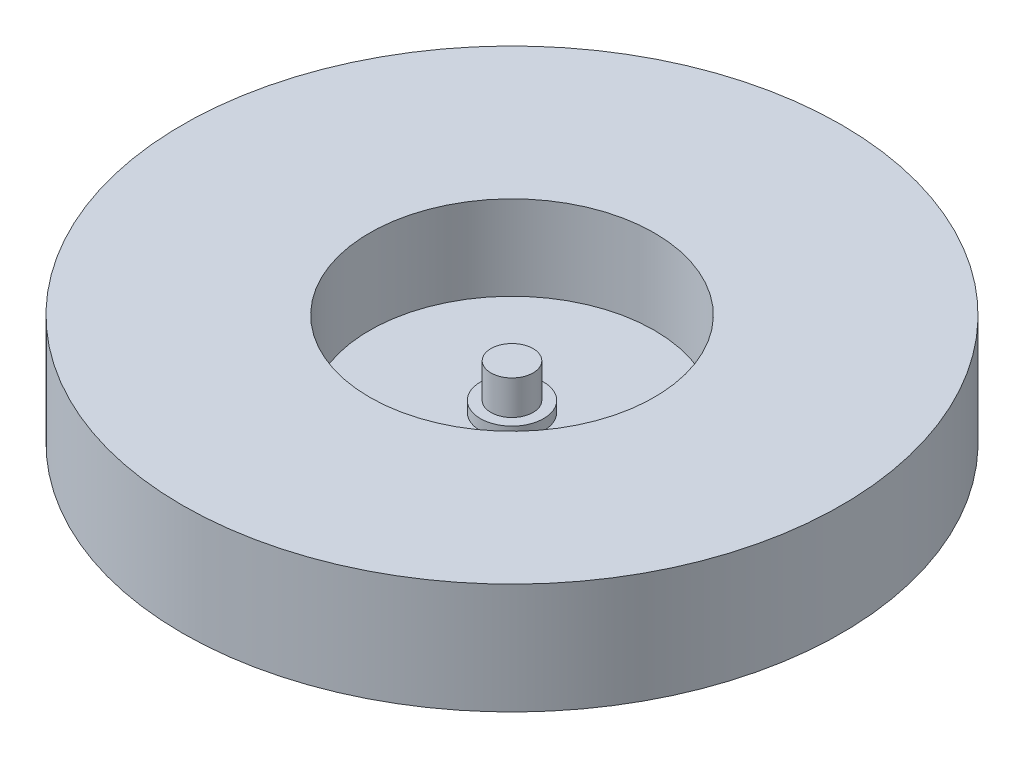
from build123d import *

# Parameters (mm, degrees)
SKETCH1_R           = 62.5
BOSS_EXTRUDE1_DEPTH = 21
SKETCH2_R           = 27
SKETCH2_R_2         = 6
CUT_EXTRUDE1_DEPTH  = 16
SKETCH3_R           = 6
SKETCH3_R_2         = 4
CUT_EXTRUDE2_DEPTH  = 14
SKETCH4_R           = 4
CUT_EXTRUDE3_DEPTH  = 7.5


with BuildPart() as part:
    # Sketch1 → Boss-Extrude1 (new body)
    with BuildSketch(Plane(origin=(0, 0, 0), x_dir=(1, 0, 0), z_dir=(0, 1, 0))):
        with Locations(Location((0, 0, 0), (0, 0, 90))):
            Circle(SKETCH1_R)
    extrude(amount=BOSS_EXTRUDE1_DEPTH)

    # Sketch2 → Cut-Extrude1 (cut)
    with BuildSketch(Plane(origin=(0, 21, 0), x_dir=(1, 0, 0), z_dir=(0, 1, 0))):
        with Locations(Location((0, 0, 0), (0, 0, 270))):
            Circle(SKETCH2_R)
        with Locations(Location((0, 0, 0), (0, 0, 270))):
            Circle(SKETCH2_R_2, mode=Mode.SUBTRACT)
    extrude(amount=-CUT_EXTRUDE1_DEPTH, mode=Mode.SUBTRACT)

    # Sketch3 → Cut-Extrude2 (cut)
    with BuildSketch(Plane(origin=(0, 21, 0), x_dir=(1, 0, 0), z_dir=(0, 1, 0))):
        with Locations(Location((0, 0, 0), (0, 0, 270))):
            Circle(SKETCH3_R)
        with Locations(Location((0, 0, 0), (0, 0, 270))):
            Circle(SKETCH3_R_2, mode=Mode.SUBTRACT)
    extrude(amount=-CUT_EXTRUDE2_DEPTH, mode=Mode.SUBTRACT)

    # Sketch4 → Cut-Extrude3 (cut)
    with BuildSketch(Plane(origin=(0, 21, 0), x_dir=(1, 0, 0), z_dir=(0, 1, 0))):
        with Locations(Location((0, 0, 0), (0, 0, 270))):
            Circle(SKETCH4_R)
    extrude(amount=-CUT_EXTRUDE3_DEPTH, mode=Mode.SUBTRACT)


solid = part.part
